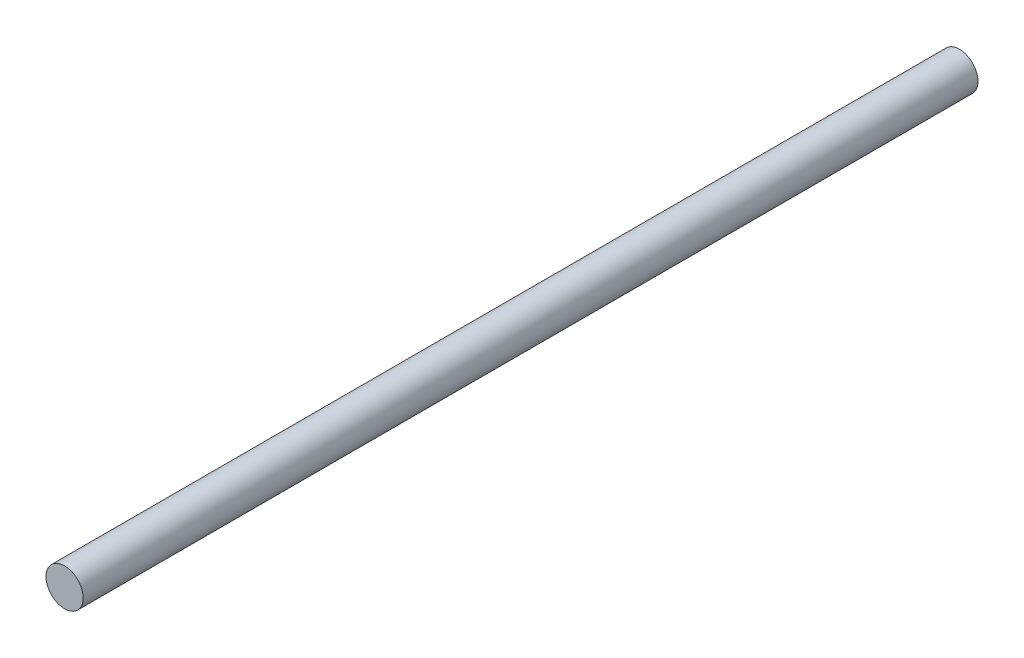
from build123d import *

# Parameters (mm, degrees)
SKETCH1_R           = 9.35
BOSS_EXTRUDE1_DEPTH = 450


with BuildPart() as part:
    # Sketch1 → Boss-Extrude1 (new body)
    with BuildSketch(Plane.XY):
        Circle(SKETCH1_R)
    extrude(amount=BOSS_EXTRUDE1_DEPTH)


solid = part.part
